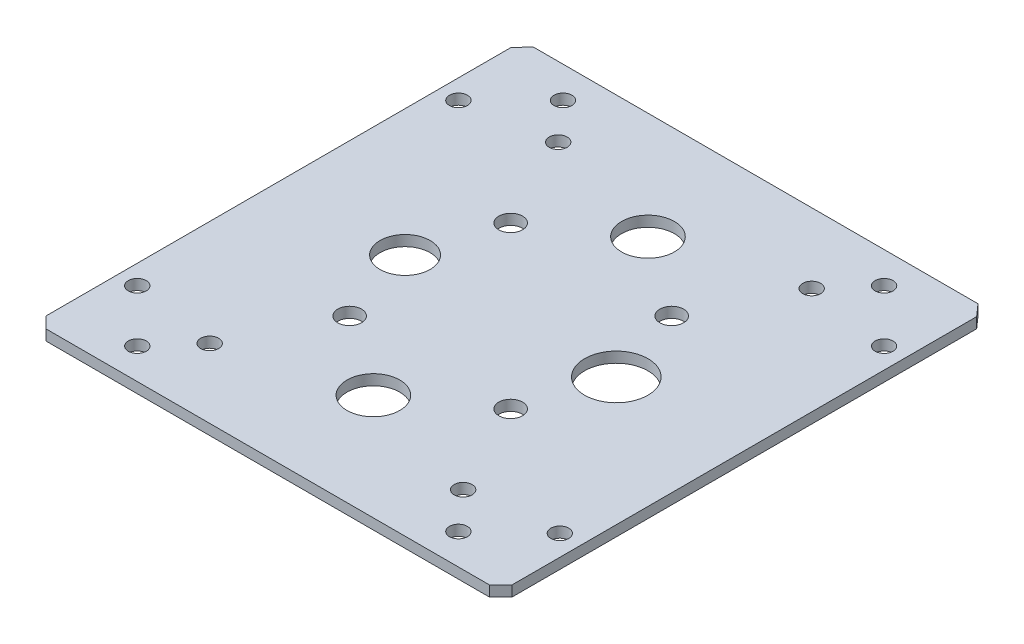
from build123d import *

# Parameters (mm, degrees)
SKETCH_1_R      = 2.25
SKETCH_1_R_2    = 1.7
SKETCH_1_R_3    = 6
SKETCH_1_R_4    = 4.75
SKETCH_1_R_5    = 5
SKETCH_1_R_6    = 1.69491354
EXTRUDE_1_DEPTH = 2


with BuildPart() as part:
    # 草图1 → 凸台-拉伸1 (new body)
    with BuildSketch(Plane(origin=(0, 0, 0), x_dir=(1, 0, 0), z_dir=(0, 1, 0))):
        Polygon((-41.878679656, -46.121320344), (42.121320344, -46.121320344), (44.23849367, -43.995861074), (44.23849367, 44.004138926), (42.249509012, 46.250010702), (-42.015698652, 46.250010702), (-44, 44), (-44, -44), align=None)
        with Locations(Location((-15.25, -15.25, 0), (0, 0, 270))):
            Circle(SKETCH_1_R, mode=Mode.SUBTRACT)
        with Locations(Location((-15.25, 15.25, 0), (0, 0, 270))):
            Circle(SKETCH_1_R, mode=Mode.SUBTRACT)
        with Locations(Location((15.25, -15.25, 0), (0, 0, 270))):
            Circle(SKETCH_1_R, mode=Mode.SUBTRACT)
        with Locations(Location((15.25, 15.25, 0), (0, 0, 270))):
            Circle(SKETCH_1_R, mode=Mode.SUBTRACT)
        with Locations(Location((-24, -33, 0), (0, 0, 270))):
            Circle(SKETCH_1_R_2, mode=Mode.SUBTRACT)
        with Locations(Location((20, 0, 0), (0, 0, 270))):
            Circle(SKETCH_1_R_3, mode=Mode.SUBTRACT)
        with Locations(Location((-20, 0, 0), (0, 0, 270))):
            Circle(SKETCH_1_R_4, mode=Mode.SUBTRACT)
        with Locations(Location((0, 26, 0), (0, 0, 270))):
            Circle(SKETCH_1_R_5, mode=Mode.SUBTRACT)
        with Locations(Location((0, -26, 0), (0, 0, 270))):
            Circle(SKETCH_1_R_5, mode=Mode.SUBTRACT)
        with Locations(Location((-30.40559154, -40.30508646, 0), (0, 0, 270))):
            Circle(SKETCH_1_R_2, mode=Mode.SUBTRACT)
        with Locations(Location((-30.40559154, 40.30508646, 0), (0, 0, 270))):
            Circle(SKETCH_1_R_2, mode=Mode.SUBTRACT)
        with Locations(Location((-40.30508646, 30.40559154, 0), (0, 0, 270))):
            Circle(SKETCH_1_R_2, mode=Mode.SUBTRACT)
        with Locations(Location((30.40559154, -40.30508646, 0), (0, 0, 270))):
            Circle(SKETCH_1_R_2, mode=Mode.SUBTRACT)
        with Locations(Location((40.30508646, -31, 0), (0, 0, 270))):
            Circle(SKETCH_1_R_6, mode=Mode.SUBTRACT)
        with Locations(Location((40.30508646, 30.40559154, 0), (0, 0, 270))):
            Circle(SKETCH_1_R_6, mode=Mode.SUBTRACT)
        with Locations(Location((30.40559154, 40.30508646, 0), (0, 0, 270))):
            Circle(SKETCH_1_R_2, mode=Mode.SUBTRACT)
        with Locations(Location((-40.30508646, -30.40559154, 0), (0, 0, 90))):
            Circle(SKETCH_1_R_2, mode=Mode.SUBTRACT)
        with Locations(Location((24, -33, 0), (0, 0, 90))):
            Circle(SKETCH_1_R_2, mode=Mode.SUBTRACT)
        with Locations(Location((24, 33, 0), (0, 0, 270))):
            Circle(SKETCH_1_R_2, mode=Mode.SUBTRACT)
        with Locations(Location((-24, 33, 0), (0, 0, 90))):
            Circle(SKETCH_1_R_2, mode=Mode.SUBTRACT)
    extrude(amount=EXTRUDE_1_DEPTH)


solid = part.part
